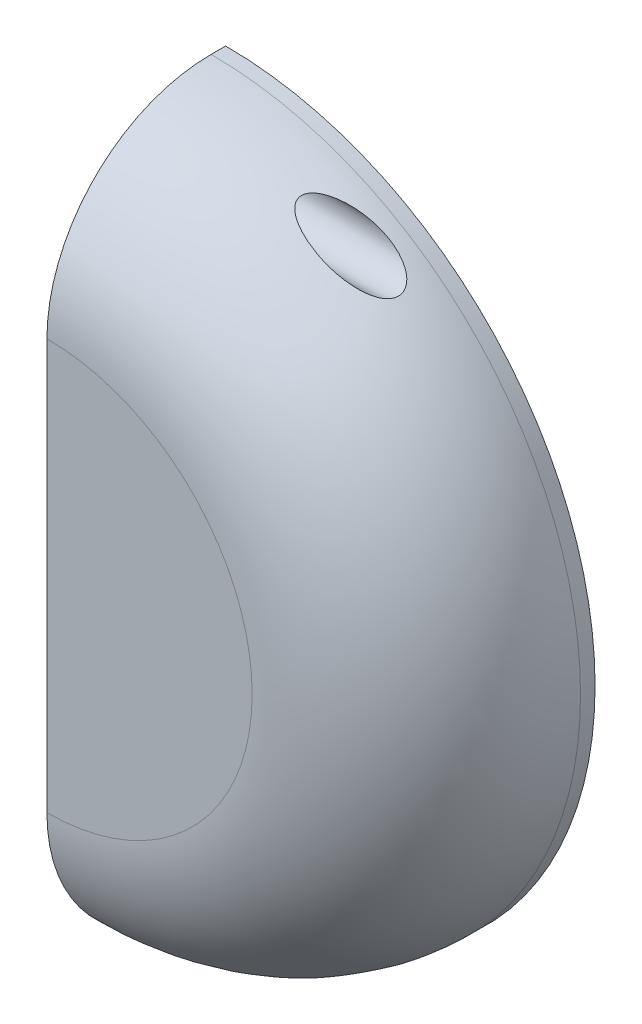
from build123d import *

# Parameters (mm, degrees)
SKETCH_1_R                     = 49.5
EXTRUDE_1_DEPTH                = 23.95
CUT_EXTRUDE_1_REACH            = 75.987
SKETCH_2_W                     = 51.856446696
SKETCH_2_H                     = 105.629558774
FILLET_1_R                     = 22
SHELL_1_T                      = -2
CUT_EXTRUDE_2_REACH            = 74.664
EXTRUDE_2_REACH                = 75.987
HOLE_WIZARD_M3_1_D             = 2.5
HOLE_WIZARD_M3_1_CSINK_D       = 2.55
HOLE_WIZARD_M3_1_CSINK_ANGLE   = 90
CUT_EXTRUDE_3_REACH            = 85.987
CUT_EXTRUDE_3_END_MAJOR_RADIUS = 27.5
CUT_EXTRUDE_3_END_MINOR_RADIUS = 22
CUT_EXTRUDE_START              = -10
SKETCH_9_R                     = 3.25


with BuildPart() as part:
    # 草图1 → 凸台-拉伸1 (new body)
    with BuildSketch(Plane.XY):
        Circle(SKETCH_1_R)
    extrude(amount=EXTRUDE_1_DEPTH)

    # 草图2 → 切除-拉伸1 (cut, up to next)
    with BuildSketch(Plane.XY, mode=Mode.PRIVATE) as cut_extrude_1_sk1:
        with Locations((-25.928223348, -1.331017626)):
            Rectangle(SKETCH_2_W, SKETCH_2_H)
    cut_extrude_1_tool1 = extrude(cut_extrude_1_sk1.sketch, amount=CUT_EXTRUDE_1_REACH, mode=Mode.PRIVATE) & part.part
    add(cut_extrude_1_tool1.solids().sort_by_distance((-25.928223, -1.331018, 0))[0], mode=Mode.SUBTRACT)

    # 圆角1
    fillet_1_edges = [part.edges().sort_by_distance(p)[0] for p in [
        (49.5, 0, 23.95),
    ]]
    fillet(fillet_1_edges, radius=FILLET_1_R)

    # 抽壳1
    shell_1_openings = [part.faces().sort_by_distance(p)[0] for p in [
        (21.008452488, 0, 0),
    ]]
    offset(amount=SHELL_1_T, openings=shell_1_openings)

    # 草图3 → 切除-拉伸2 (cut, up to next)
    with BuildSketch(Plane(origin=(2, 0, 0), x_dir=(0, 0, -1), z_dir=(1, 0, 0)), mode=Mode.PRIVATE) as cut_extrude_2_sk1:
        with BuildLine():
            Line((0, -47.457876059), (0, 47.457876059))
            Line((0, 47.457876059), (-1.95, 47.457876059))
            add(Edge.make_bspline(
                [(-1.95, 47.457876059), (-3.271867558, 47.457876059), (-4.580203295, 47.327986162), (-6.522470102, 46.938901335), (-7.160902253, 46.77755623), (-8.411173988, 46.395772827), (-9.637851686, 45.954297745), (-10.817777712, 45.394543369), (-11.973866888, 44.77448301), (-12.542496397, 44.432343138), (-14.177790511, 43.334814725), (-15.183450399, 42.505596807), (-16.567061926, 41.11769353), (-17.007634716, 40.630474323), (-17.843988232, 39.607544633), (-18.233424143, 39.079675999), (-19.318498452, 37.448564759), (-19.931677485, 36.298258611), (-20.683423408, 34.476900758), (-20.905979728, 33.851839293), (-21.284471808, 32.596856934), (-21.441928362, 31.963754853), (-21.820924381, 30.047967998), (-21.95, 28.748963189), (-21.95, 27.427176304)],
                knots=[0, 0, 0, 0, 0.125, 0.125, 0.1875, 0.1875, 0.25, 0.3125, 0.3125, 0.375, 0.375, 0.5, 0.5, 0.5625, 0.5625, 0.625, 0.625, 0.75, 0.75, 0.8125, 0.8125, 0.875, 0.875, 1, 1, 1, 1], degree=3))
            Line((-21.95, 27.427176304), (-21.95, -27.427176304))
            add(Edge.make_bspline(
                [(-21.95, -27.427176304), (-21.95, -28.748751501), (-21.820948006, -30.055931988), (-21.434879621, -31.995231967), (-21.273831263, -32.636531268), (-20.893390258, -33.888912081), (-20.453566277, -35.116841913), (-19.896522444, -36.29650639), (-19.279955682, -37.451662261), (-18.939789489, -38.019997246), (-17.843776455, -39.660921393), (-17.016258232, -40.668628413), (-15.633066823, -42.053808837), (-15.148182071, -42.494322146), (-14.129233176, -43.331552566), (-13.599488217, -43.724395897), (-11.969055187, -44.81417128), (-10.820320521, -45.429209656), (-9.003708201, -46.18303121), (-8.379162057, -46.406777614), (-7.12245463, -46.787996047), (-6.488637543, -46.946528678), (-4.571162151, -47.328045624), (-3.271637617, -47.457876059), (-1.95, -47.457876059)],
                knots=[0, 0, 0, 0, 0.125, 0.125, 0.1875, 0.1875, 0.25, 0.3125, 0.3125, 0.375, 0.375, 0.5, 0.5, 0.5625, 0.5625, 0.625, 0.625, 0.75, 0.75, 0.8125, 0.8125, 0.875, 0.875, 1, 1, 1, 1], degree=3))
            Line((-1.95, -47.457876059), (0, -47.457876059))
        make_face()
    cut_extrude_2_tool1 = extrude(cut_extrude_2_sk1.sketch, amount=-CUT_EXTRUDE_2_REACH, mode=Mode.PRIVATE) & part.part
    add(cut_extrude_2_tool1.solids().sort_by_distance((2, -4e-06, 10.389853))[0], mode=Mode.SUBTRACT)

    # 草图4 → 凸台-拉伸2 (add, up to next)
    with BuildSketch(Plane(origin=(0, 0, 0), x_dir=(-1, 0, 0), z_dir=(0, 0, -1)), mode=Mode.PRIVATE) as extrude_2_sk1:
        with BuildLine():
            Line((0, 36.5), (-30.397368307, 36.5))
            ThreePointArc((-30.397368307, 36.5), (-16.163229875, 44.665422868), (0, 47.5))
            Line((0, 47.5), (0, 36.5))
        make_face()
    extrude_2_tool1 = extrude(extrude_2_sk1.sketch, amount=-EXTRUDE_2_REACH, mode=Mode.PRIVATE) - part.part
    extrude_2 = extrude_2_tool1.solids().sort_by_distance((11.598273, 40.946819, 0))[0]
    add(extrude_2)

    # 镜向1: 凸台-拉伸2 mirrored; each copy of 凸台-拉伸2 runs up to whatever stops it at its own place
    mirror_1_before = part.part  # the part as the pattern finds it: every copy runs up to it
    mirror_1_extrude_2_long = extrude(extrude_2_sk1.sketch, amount=-EXTRUDE_2_REACH, mode=Mode.PRIVATE)
    mirror_1_extrude_2_tool1 = mirror_1_extrude_2_long.mirror(Plane.ZX) - mirror_1_before
    add(mirror_1_extrude_2_tool1.solids().sort_by_distance((11.598273, -40.946819, 0))[0])

    # M3 螺纹孔的螺纹孔钻头1 (through all)
    with Locations(Plane.ZY):
        with Locations((7.25, 42), (7.25, -42)):
            CounterSinkHole(HOLE_WIZARD_M3_1_D / 2, HOLE_WIZARD_M3_1_CSINK_D / 2, counter_sink_angle=HOLE_WIZARD_M3_1_CSINK_ANGLE)

    # 切除-拉伸3: up to this torus (the profile starts inside it)
    cut_extrude_3_end = Plane(origin=(0, 0, 1.95), z_dir=(0, 0, 1)) * Torus(CUT_EXTRUDE_3_END_MAJOR_RADIUS, CUT_EXTRUDE_3_END_MINOR_RADIUS, mode=Mode.PRIVATE)
    # 草图9 → 切除-拉伸3 (cut, up to the surface)
    with BuildSketch(Plane.ZY.offset(CUT_EXTRUDE_START), mode=Mode.PRIVATE) as cut_extrude_3_sk1:
        with Locations((7.25, 42)):
            Circle(SKETCH_9_R)
    cut_extrude_3_tool1 = extrude(cut_extrude_3_sk1.sketch, amount=-CUT_EXTRUDE_3_REACH, mode=Mode.PRIVATE) & cut_extrude_3_end
    add(cut_extrude_3_tool1.solids().sort_by_distance((10, 42, 7.25))[0], mode=Mode.SUBTRACT)
    # 草图9 → 切除-拉伸3 (cut, up to the surface)
    with BuildSketch(Plane.ZY.offset(CUT_EXTRUDE_START), mode=Mode.PRIVATE) as cut_extrude_3_sk2:
        with Locations((7.25, -42)):
            Circle(SKETCH_9_R)
    cut_extrude_3_tool2 = extrude(cut_extrude_3_sk2.sketch, amount=-CUT_EXTRUDE_3_REACH, mode=Mode.PRIVATE) & cut_extrude_3_end
    add(cut_extrude_3_tool2.solids().sort_by_distance((10, -42, 7.25))[0], mode=Mode.SUBTRACT)


solid = part.part
